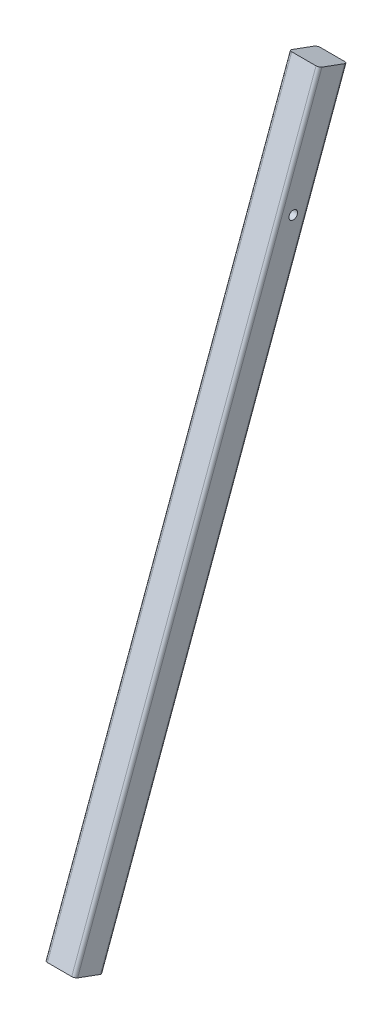
from build123d import *

# Parameters (mm, degrees)
SKETCH1_W                  = 30
SKETCH1_H                  = 700
BOSS_EXTRUDE1_DEPTH        = 30
F_8_5_8_5_DIAMETER_HOLE1_D = 8.5
FILLET1_R                  = 3


with BuildPart() as part:
    # Sketch1 → Boss-Extrude1 (new body)
    with BuildSketch(Plane(origin=(0, 581.941084715, 1587.910176451), x_dir=(-1, 0, 0), z_dir=(0, 0.3441021099188428, 0.9389322328844616))):
        with Locations((13.69090897, 276.656236502)):
            Rectangle(SKETCH1_W, SKETCH1_H)
    extrude(amount=-BOSS_EXTRUDE1_DEPTH)

    # Ø8.5 (8.5) Diameter Hole1 (through all)
    with Locations(Plane(origin=(1.30909103, 0, 0), x_dir=(0, 0, -1), z_dir=(1, 0, 0))):
        with Locations((-1588.160191829, 537.667169913)):
            Hole(F_8_5_8_5_DIAMETER_HOLE1_D / 2)

    # Fillet1
    fillet1_edges = [part.edges().sort_by_distance(p)[0] for p in [
        (1.30909103, 311.856563537, 1654.940204167),
        (-28.69090897, 311.856563537, 1654.940204167),
        (1.30909103, 322.179626834, 1683.108171153),
        (-28.69090897, 322.179626834, 1683.108171153),
    ]]
    fillet(fillet1_edges, radius=FILLET1_R)


solid = part.part
